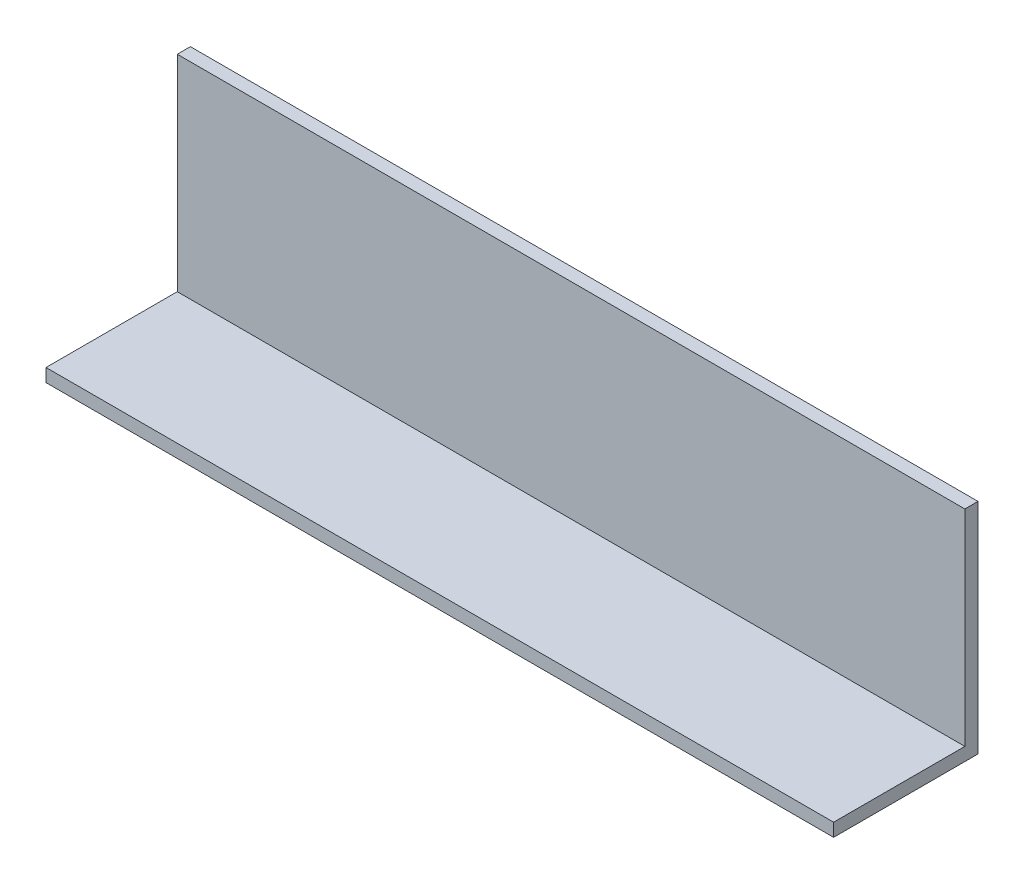
from build123d import *

# Parameters (mm, degrees)
SKETCH1_W           = 1800
SKETCH1_H           = 500
BOSS_EXTRUDE1_DEPTH = 30
SKETCH2_W           = 1800
SKETCH2_H           = 30
BOSS_EXTRUDE2_DEPTH = 300


with BuildPart() as part:
    # Sketch1 → Boss-Extrude1 (new body)
    with BuildSketch(Plane.XY):
        Rectangle(SKETCH1_W, SKETCH1_H)
    extrude(amount=BOSS_EXTRUDE1_DEPTH)

    # Sketch2 → Boss-Extrude2 (add)
    with BuildSketch(Plane.XY.offset(30)):
        with Locations((0, -235)):
            Rectangle(SKETCH2_W, SKETCH2_H)
    extrude(amount=BOSS_EXTRUDE2_DEPTH)


solid = part.part
